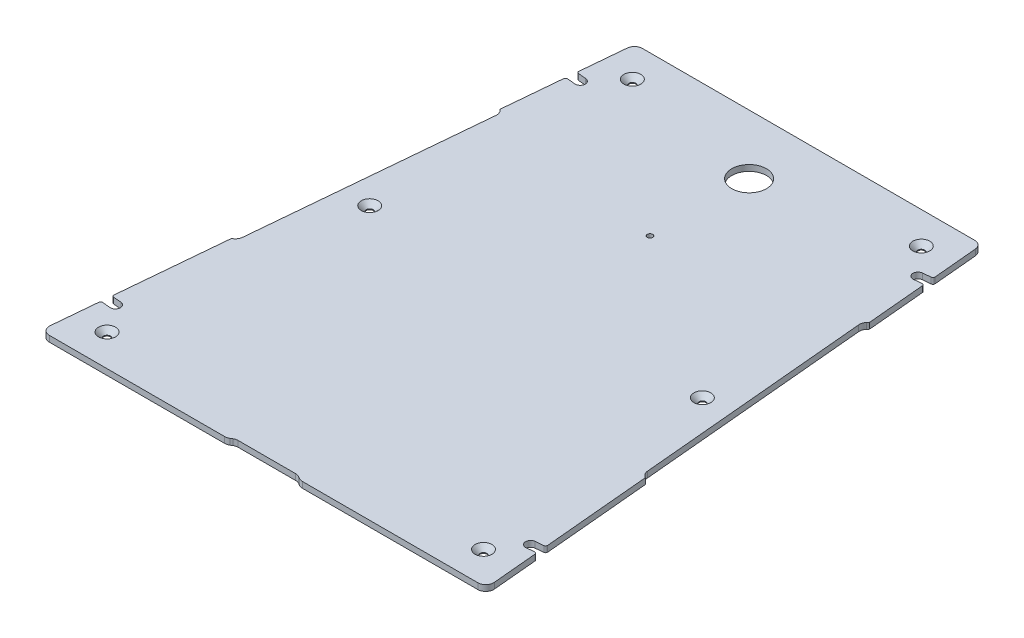
from build123d import *

# Parameters (mm, degrees)
SKETCH1_R           = 17.5
SKETCH1_R_2         = 3.4
SKETCH1_R_3         = 2.731026391
BOSS_EXTRUDE1_DEPTH = 6
FILLET1_R           = 8
CUT_EXTRUDE5_DEPTH  = 10
CUT_EXTRUDE6_DEPTH  = 10
FILLET2_R           = 8
CHAMFER1_SIZE       = 5.15
CUT_EXTRUDE7_DEPTH  = 10
FILLET3_R           = 2


with BuildPart() as part:
    # Sketch1 → Boss-Extrude1 (new body)
    with BuildSketch(Plane(origin=(0, 0, 0), x_dir=(1, 0, 0), z_dir=(0, 1, 0))):
        Polygon((-175, 275), (-225, -275), (225, -275), (175, 275), align=None)
        with Locations(Location((0, 215, 0), (0, 0, 270))):
            Circle(SKETCH1_R, mode=Mode.SUBTRACT)
        with Locations(Location((-145.777131586, 243, 0), (0, 0, 270))):
            Circle(SKETCH1_R_2, mode=Mode.SUBTRACT)
        with Locations(Location((145.777131586, 243, 0), (0, 0, 90))):
            Circle(SKETCH1_R_2, mode=Mode.SUBTRACT)
        with Locations(Location((-189.958949768, -243, 0), (0, 0, 270))):
            Circle(SKETCH1_R_2, mode=Mode.SUBTRACT)
        with Locations(Location((189.958949768, -243, 0), (0, 0, 90))):
            Circle(SKETCH1_R_2, mode=Mode.SUBTRACT)
        with Locations(Location((-167.868040677, 0, 0), (0, 0, 270))):
            Circle(SKETCH1_R_2, mode=Mode.SUBTRACT)
        with Locations(Location((167.868040677, 0, 0), (0, 0, 90))):
            Circle(SKETCH1_R_2, mode=Mode.SUBTRACT)
        with Locations(Location((0, 115, 0), (0, 0, 270))):
            Circle(SKETCH1_R_3, mode=Mode.SUBTRACT)
    extrude(amount=-BOSS_EXTRUDE1_DEPTH)

    # Fillet1
    fillet1_edges = [part.edges().sort_by_distance(p)[0] for p in [
        (175, -3, -275),
        (225, -3, 275),
        (-225, -3, 275),
        (-175, -3, -275),
    ]]
    fillet(fillet1_edges, radius=FILLET1_R)

    # Sketch6 → Cut-Extrude5 (cut)
    with BuildSketch(Plane(origin=(0, 0, 0), x_dir=(1, 0, 0), z_dir=(0, 1, 0))):
        Polygon((-204.631966366, -95.133074099), (-182.722315824, 145.873081867), (-194.245635018, 159.701064899), (-218.459949399, -106.656393293), align=None)
    cut_extrude5 = extrude(amount=-CUT_EXTRUDE5_DEPTH, mode=Mode.SUBTRACT)

    # Sketch7 → Cut-Extrude6 (cut)
    with BuildSketch(Plane(origin=(0, 0, 0), x_dir=(1, 0, 0), z_dir=(0, 1, 0))):
        Polygon((-31.320564901, -271.594250629), (31.320564901, -271.594250629), (45, -279.893229805), (-45, -279.893229805), align=None)
    extrude(amount=-CUT_EXTRUDE6_DEPTH, mode=Mode.SUBTRACT)

    # Mirror2: Cut-Extrude5 across plane
    add(cut_extrude5.mirror(Plane(origin=(0, 0, 0), x_dir=(0, 0, 1), z_dir=(1, 0, 0))), mode=Mode.SUBTRACT)

    # Fillet2
    fillet2_edges = [part.edges().sort_by_distance(p)[0] for p in [
        (36.934355042, -3, 275),
        (-36.934355042, -3, 275),
        (-31.320564901, -3, 271.594250629),
        (31.320564901, -3, 271.594250629),
        (204.631966366, -3, 95.133074099),
        (182.722315824, -3, -145.873081867),
        (-182.722315824, -3, -145.873081867),
        (-204.631966366, -3, 95.133074099),
    ]]
    fillet(fillet2_edges, radius=FILLET2_R)

    # Chamfer1
    chamfer1_edges = [part.edges().sort_by_distance(p)[0] for p in [
        (-145.777131586, 0, -246.4),
        (145.777131586, 0, -239.6),
        (-189.958949768, 0, 239.6),
        (189.958949768, 0, 246.4),
        (-167.868040677, 0, -3.4),
        (167.868040677, 0, 3.4),
    ]]
    chamfer(chamfer1_edges, length=CHAMFER1_SIZE)

    # Sketch11 → Cut-Extrude7 (cut)
    with BuildSketch(Plane(origin=(0, 0, 0), x_dir=(1, 0, 0), z_dir=(0, 1, 0))):
        with BuildLine():
            Line((-179.910507926, 220.984412813), (-169.951575861, 220.079055353))
            ThreePointArc((-169.951575861, 220.079055353), (-165.334252813, 214.538267695), (-170.875040471, 209.920944647))
            Line((-170.875040471, 209.920944647), (-180.833972536, 210.826302107))
            Line((-180.833972536, 210.826302107), (-179.910507926, 220.984412813))
        make_face()
        with BuildLine():
            Line((-219.001417017, -209.015587187), (-209.042484952, -209.920944647))
            ThreePointArc((-209.042484952, -209.920944647), (-204.425161904, -215.461732305), (-209.965949562, -220.079055353))
            Line((-209.965949562, -220.079055353), (-219.924881627, -219.173697893))
            Line((-219.924881627, -219.173697893), (-219.001417017, -209.015587187))
        make_face()
        with BuildLine():
            Line((219.001417017, -209.015587187), (219.924881627, -219.173697893))
            Line((219.924881627, -219.173697893), (209.965949562, -220.079055353))
            ThreePointArc((209.965949562, -220.079055353), (204.425161904, -215.461732305), (209.042484952, -209.920944647))
            Line((209.042484952, -209.920944647), (219.001417017, -209.015587187))
        make_face()
        with BuildLine():
            Line((179.910507926, 220.984412813), (180.833972536, 210.826302107))
            Line((180.833972536, 210.826302107), (170.875040471, 209.920944647))
            ThreePointArc((170.875040471, 209.920944647), (165.334252813, 214.538267695), (169.951575861, 220.079055353))
            Line((169.951575861, 220.079055353), (179.910507926, 220.984412813))
        make_face()
    extrude(amount=-CUT_EXTRUDE7_DEPTH, mode=Mode.SUBTRACT)

    # Fillet3
    fillet3_edges = [part.edges().sort_by_distance(p)[0] for p in [
        (-180.833972536, -3, -210.826302107),
        (-179.910507926, -3, -220.984412813),
        (-219.924881627, -3, 219.173697893),
        (-219.001417017, -3, 209.015587187),
        (179.910507926, -3, -220.984412813),
        (180.833972536, -3, -210.826302107),
        (219.001417017, -3, 209.015587187),
        (219.924881627, -3, 219.173697893),
    ]]
    fillet(fillet3_edges, radius=FILLET3_R)


solid = part.part
